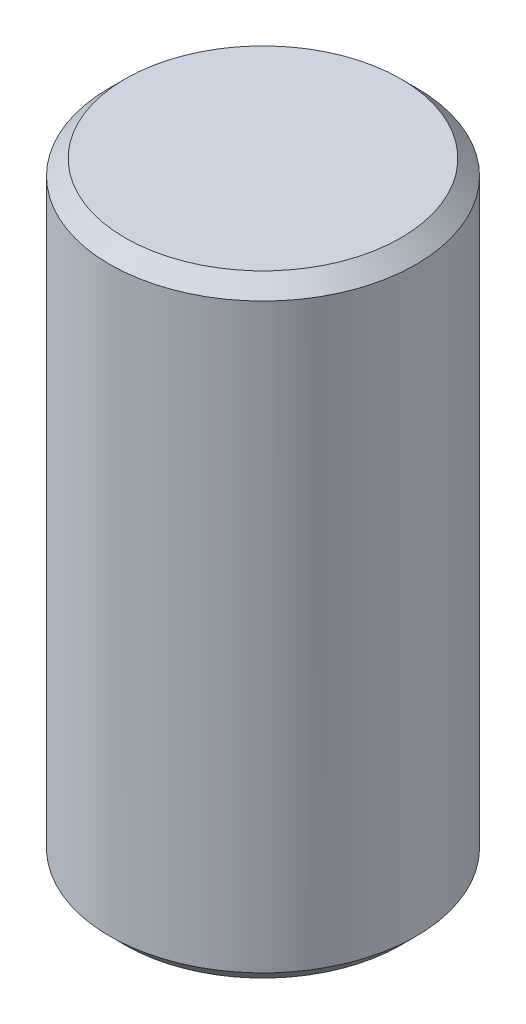
from build123d import *

# Parameters (mm, degrees)
SKIZZE1_W  = 5
SKIZZE1_H  = 20
FASE1_SIZE = 0.5


with BuildPart() as part:
    # Skizze1 → Rotation1 (revolve)
    with BuildSketch(Plane.XY, mode=Mode.PRIVATE) as rotation1_sk:
        with Locations((2.5, 10)):
            Rectangle(SKIZZE1_W, SKIZZE1_H)
    revolve(rotation1_sk.sketch.rotate(Axis((0, 0, 0), (0, 1, 0)), 90), axis=Axis((0, 0, 0), (0, 1, 0)))

    # Fase1
    fase1_edges = [part.edges().sort_by_distance(p)[0] for p in [
        (0, 0, 5),
        (0, 20, 5),
    ]]
    chamfer(fase1_edges, length=FASE1_SIZE)


solid = part.part
